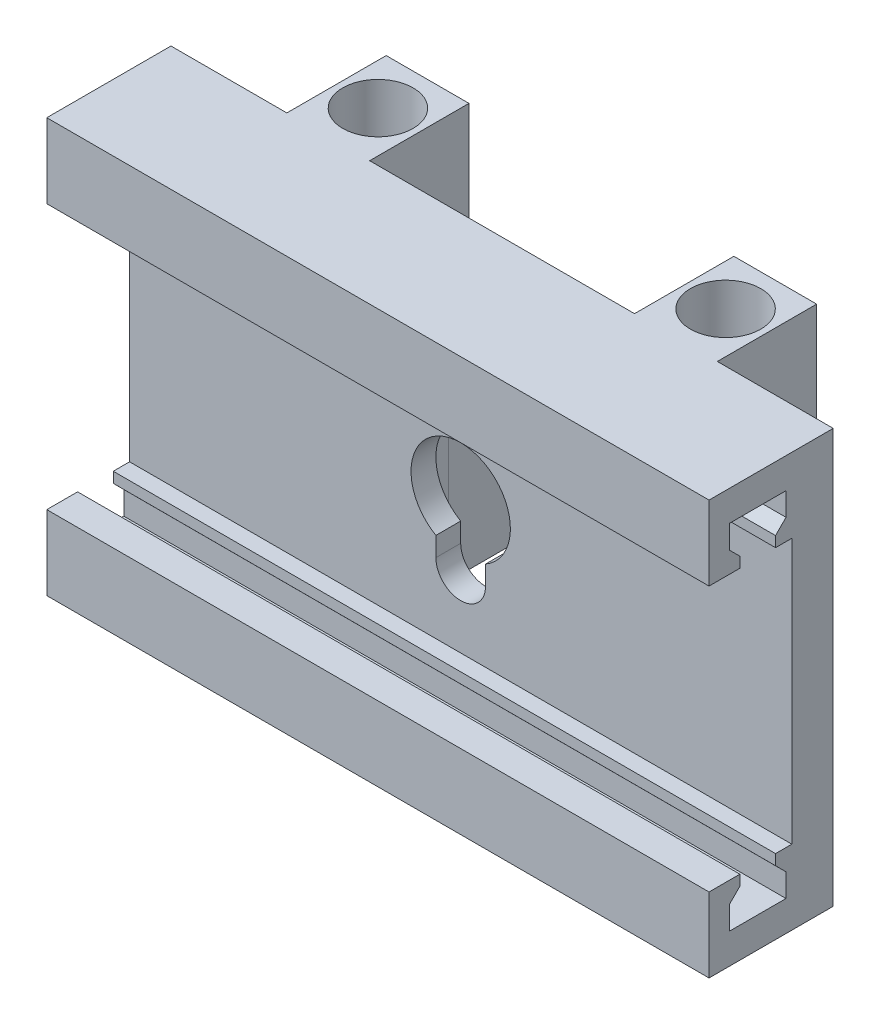
from build123d import *

# Parameters (mm, degrees)
SKETCH2_W           = 80
SKETCH2_H           = 50
BOSS_EXTRUDE1_DEPTH = 5
CUT_EXTRUDE1_DEPTH  = 10
SKETCH4_W           = 13
SKETCH4_H           = 23
CUT_EXTRUDE2_DEPTH  = 2
SKETCH6_W           = 13
SKETCH6_H           = 4.7
SKETCH6_R           = 1.5
BOSS_EXTRUDE2_DEPTH = 3
SKETCH10_W          = 80
SKETCH10_H          = 9
BOSS_EXTRUDE5_DEPTH = 10
CUT_EXTRUDE3_DEPTH  = 86.14693183
SKETCH13_W          = 10
SKETCH13_H          = 50
BOSS_EXTRUDE6_DEPTH = 12
SKETCH14_R          = 4.25
CUT_EXTRUDE4_DEPTH  = 66.76473219
SKETCH17_W          = 6.937355762
SKETCH17_H          = 20.309439226
BOSS_EXTRUDE7_DEPTH = 10
SKETCH18_W          = 5.321998735
SKETCH18_H          = 9.21217238
SKETCH18_W_2        = 3
SKETCH18_H_2        = 5.5
CUT_EXTRUDE5_DEPTH  = 53.782572882


with BuildPart() as part:
    # Sketch2 → Boss-Extrude1 (new body)
    with BuildSketch(Plane.XY):
        Rectangle(SKETCH2_W, SKETCH2_H)
    extrude(amount=BOSS_EXTRUDE1_DEPTH)

    # Sketch3 → Cut-Extrude1 (cut)
    with BuildSketch(Plane(origin=(0, 0, 0), x_dir=(-1, 0, 0), z_dir=(0, 0, -1))):
        with BuildLine():
            Line((-3, -5.196152423), (-3, -7.523942422))
            ThreePointArc((-3, -7.523942422), (0, -10.523942422), (3, -7.523942422))
            Line((3, -7.523942422), (3, -5.196152423))
            ThreePointArc((3, -5.196152423), (0, 6), (-3, -5.196152423))
        make_face()
    extrude(amount=-CUT_EXTRUDE1_DEPTH, mode=Mode.SUBTRACT)

    # Sketch4 → Cut-Extrude2 (cut)
    with BuildSketch(Plane(origin=(0, 0, 0), x_dir=(-1, 0, 0), z_dir=(0, 0, -1))):
        with Locations((0, -5.5)):
            Rectangle(SKETCH4_W, SKETCH4_H)
    extrude(amount=-CUT_EXTRUDE2_DEPTH, mode=Mode.SUBTRACT)

    # Sketch6 → Boss-Extrude2 (add)
    # profile 1 of 2: a face of its own
    with BuildSketch(Plane(origin=(0, 0, 0), x_dir=(-1, 0, 0), z_dir=(0, 0, -1))):
        with Locations((0, -19.35)):
            Rectangle(SKETCH6_W, SKETCH6_H)
        with Locations((0, -19.5)):
            Circle(SKETCH6_R, mode=Mode.SUBTRACT)
    # profile 2 of 2: a face of its own
    with BuildSketch(Plane(origin=(0, 0, 0), x_dir=(-1, 0, 0), z_dir=(0, 0, -1))):
        with Locations((0, 8.35)):
            Rectangle(SKETCH6_W, SKETCH6_H)
        with Locations(Location((0, 8.5, 0), (0, 0, 180))):
            Circle(SKETCH6_R, mode=Mode.SUBTRACT)
    extrude(amount=BOSS_EXTRUDE2_DEPTH)

    # Sketch10 → Boss-Extrude5 (add)
    with BuildSketch(Plane.XY.offset(5)):
        with Locations((0, 20.5)):
            Rectangle(SKETCH10_W, SKETCH10_H)
        with Locations((0, -20.5)):
            Rectangle(SKETCH10_W, SKETCH10_H)
    extrude(amount=BOSS_EXTRUDE5_DEPTH)

    # Sketch11 → Cut-Extrude3 (cut, through all)
    with BuildSketch(Plane(origin=(40, 0, 0), x_dir=(0, 0, -1), z_dir=(1, 0, 0))):
        Polygon((-11.279093119, 16), (-11.279093119, 17.27), (-12.551885325, 18.542792206), (-12.551885325, 21.332792206), (-5.701885325, 21.332792206), (-5.701885325, 18.542792206), (-6.969093119, 17.27), (-6.969093119, 16), align=None)
        Polygon((-11.279093119, -16), (-6.969093119, -16), (-6.969093119, -17.27), (-5.701885325, -18.542792206), (-5.701885325, -21.332792206), (-12.551885325, -21.332792206), (-12.551885325, -18.542792206), (-11.279093119, -17.27), align=None)
    extrude(amount=-CUT_EXTRUDE3_DEPTH, mode=Mode.SUBTRACT)

    # Sketch13 → Boss-Extrude6 (add)
    with BuildSketch(Plane(origin=(0, 0, 0), x_dir=(-1, 0, 0), z_dir=(0, 0, -1))):
        with Locations((-21, 0)):
            Rectangle(SKETCH13_W, SKETCH13_H)
        with Locations((21, 0)):
            Rectangle(SKETCH13_W, SKETCH13_H)
    extrude(amount=BOSS_EXTRUDE6_DEPTH)

    # Sketch14 → Cut-Extrude4 (cut, through all)
    with BuildSketch(Plane(origin=(0, 25, 0), x_dir=(1, 0, 0), z_dir=(0, 1, 0))):
        with Locations(Location((-21, 6, 0), (0, 0, 270))):
            Circle(SKETCH14_R)
        with Locations(Location((21, 6, 0), (0, 0, 90))):
            Circle(SKETCH14_R)
    extrude(amount=-CUT_EXTRUDE4_DEPTH, mode=Mode.SUBTRACT)

    # Sketch17 → Boss-Extrude7 (add)
    with BuildSketch(Plane(origin=(0, 0, 0), x_dir=(-1, 0, 0), z_dir=(0, 0, -1))):
        with Locations((10.005383819, -4.154719613)):
            Rectangle(SKETCH17_W, SKETCH17_H)
        with Locations((-10.005383819, -4.154719613)):
            Rectangle(SKETCH17_W, SKETCH17_H)
    extrude(amount=BOSS_EXTRUDE7_DEPTH)

    # Sketch18 → Cut-Extrude5 (cut, through all)
    with BuildSketch(Plane(origin=(0, 6, 0), x_dir=(1, 0, 0), z_dir=(0, 1, 0))):
        with Locations((10.030343861, 4.611072031)):
            Rectangle(SKETCH18_W, SKETCH18_H)
        with Locations((-10.810103866, 5.140004806)):
            Rectangle(SKETCH18_W_2, SKETCH18_H_2)
    extrude(amount=-CUT_EXTRUDE5_DEPTH, mode=Mode.SUBTRACT)


solid = part.part
